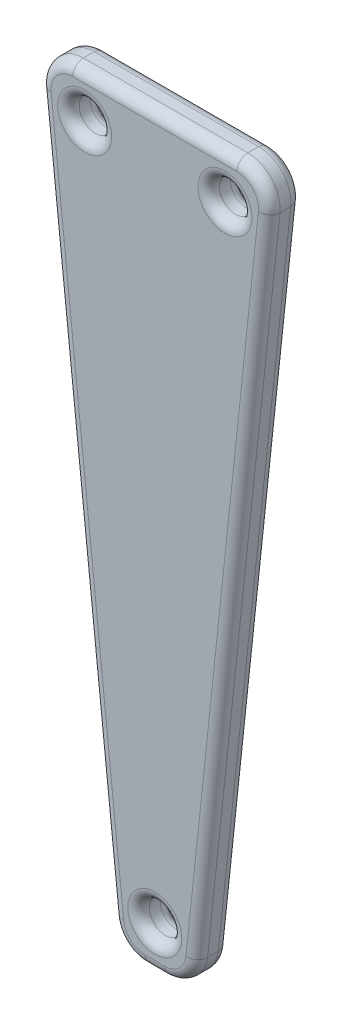
from build123d import *

# Parameters (mm, degrees)
SKETCH1_R           = 1.5
BOSS_EXTRUDE1_DEPTH = 3
FILLET1_R           = 1


with BuildPart() as part:
    # Sketch1 → Boss-Extrude1 (new body)
    with BuildSketch(Plane.XY):
        with BuildLine():
            Line((-4.095220054, 0.682539084), (2.617615572, -62.397460916))
            ThreePointArc((2.617615572, -62.397460916), (3.594828053, -64.310737854), (5.600771378, -65.08))
            Line((5.600771378, -65.08), (7.399228622, -65.08))
            ThreePointArc((7.399228622, -65.08), (9.405171947, -64.310737854), (10.382384428, -62.397460916))
            Line((10.382384428, -62.397460916), (17.095220054, 0.682539084))
            ThreePointArc((17.095220054, 0.682539084), (16.342802101, 3.005943326), (14.112064247, 4))
            Line((14.112064247, 4), (-1.112064247, 4))
            ThreePointArc((-1.112064247, 4), (-3.342802101, 3.005943326), (-4.095220054, 0.682539084))
        make_face()
        Circle(SKETCH1_R, mode=Mode.SUBTRACT)
        with Locations((13, 0)):
            Circle(SKETCH1_R, mode=Mode.SUBTRACT)
        with Locations((6.5, -61.08)):
            Circle(SKETCH1_R, mode=Mode.SUBTRACT)
    extrude(amount=BOSS_EXTRUDE1_DEPTH)

    # Fillet1
    fillet1_edges = [part.edges().sort_by_distance(p)[0] for p in [
        (13.738802241, -30.857460916, 0),
        (9.405171947, -64.310737854, 0),
        (6.5, -65.08, 0),
        (3.594828053, -64.310737854, 0),
        (9.405171947, -64.310737854, 3),
        (13.738802241, -30.857460916, 3),
        (16.342802101, 3.005943326, 3),
        (-1.5, 0, 0),
        (-1.5, 0, 3),
        (6.5, 4, 3),
        (11.5, 0, 0),
        (11.5, 0, 3),
        (-3.342802101, 3.005943326, 3),
        (5, -61.08, 0),
        (5, -61.08, 3),
        (-0.738802241, -30.857460916, 3),
        (3.594828053, -64.310737854, 3),
        (-0.738802241, -30.857460916, 0),
        (6.5, -65.08, 3),
        (-3.342802101, 3.005943326, 0),
        (6.5, 4, 0),
        (16.342802101, 3.005943326, 0),
    ]]
    fillet(fillet1_edges, radius=FILLET1_R)


solid = part.part
